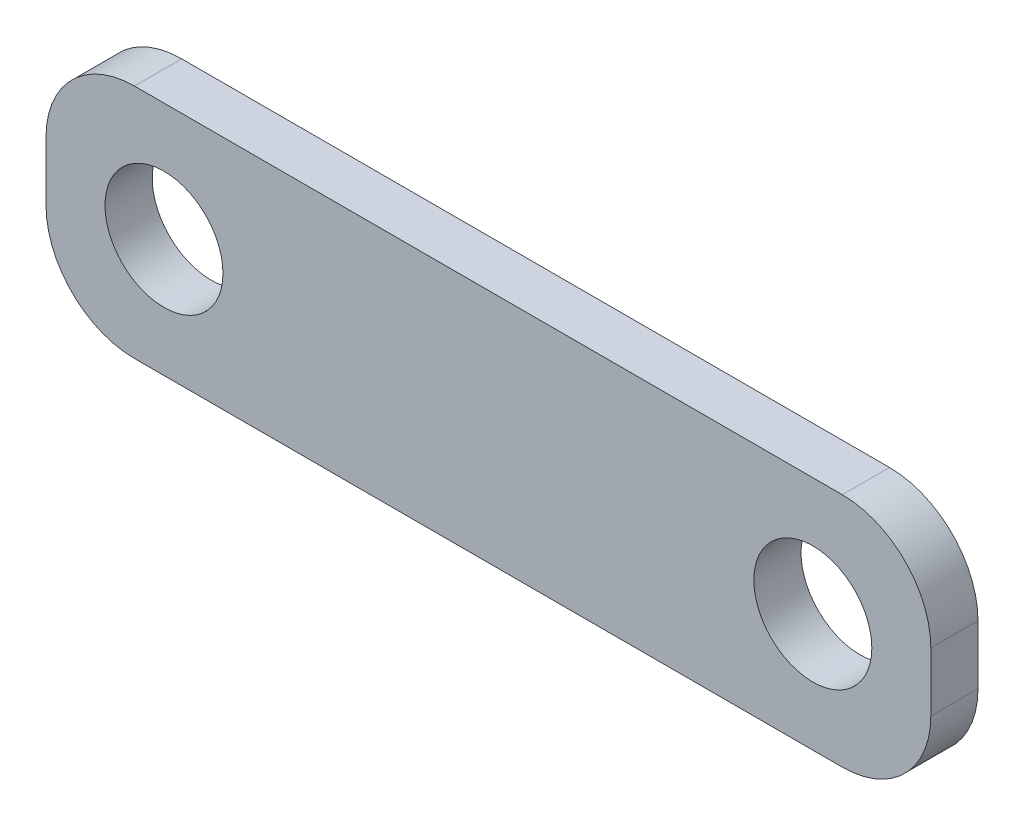
from build123d import *

# Parameters (mm, degrees)
ESBO_O1_W                = 150
ESBO_O1_H                = 40
RESSALTO_EXTRUS_O1_DEPTH = 4
FILETE2_R                = 15
FUROS_GUIA_COM_20_0MM1_D = 20


with BuildPart() as part:
    # Esboço1 → Ressalto-extrusão1 (new, symmetric)
    with BuildSketch(Plane.XY):
        with Locations((75, 20)):
            Rectangle(ESBO_O1_W, ESBO_O1_H)
    extrude(amount=RESSALTO_EXTRUS_O1_DEPTH, both=True)

    # Filete2
    filete2_edges = [part.edges().sort_by_distance(p)[0] for p in [
        (0, 0, 0),
        (0, 40, 0),
        (150, 40, 0),
        (150, 0, 0),
    ]]
    fillet(filete2_edges, radius=FILETE2_R)

    # Furos-guia com Ø20.0mm1 (through all)
    with Locations(Plane.XY.offset(4)):
        with Locations((20, 20), (130, 20)):
            Hole(FUROS_GUIA_COM_20_0MM1_D / 2)


solid = part.part
